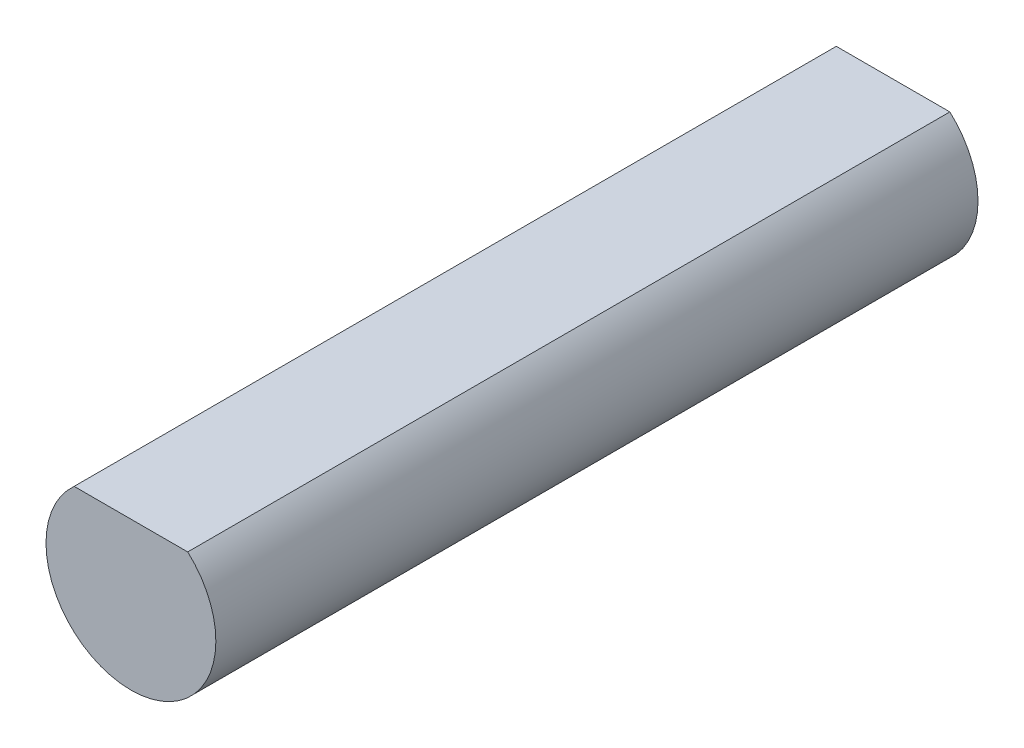
from build123d import *

# Parameters (mm, degrees)
SKETCH_1_R          = 3.9
EXTRUDE_1_DEPTH     = 35
SKETCH_2_W          = 9.684871257
SKETCH_2_H          = 3.943126155
CUT_EXTRUDE_1_DEPTH = 36.431906525


with BuildPart() as part:
    # 草图1 → 凸台-拉伸1 (new body)
    with BuildSketch(Plane.XY):
        Circle(SKETCH_1_R)
    extrude(amount=EXTRUDE_1_DEPTH)

    # 草图2 → 切除-拉伸1 (cut, through all)
    with BuildSketch(Plane.XY.offset(35)):
        with Locations((-0.499252515, 4.871563078)):
            Rectangle(SKETCH_2_W, SKETCH_2_H)
    extrude(amount=-CUT_EXTRUDE_1_DEPTH, mode=Mode.SUBTRACT)


solid = part.part
